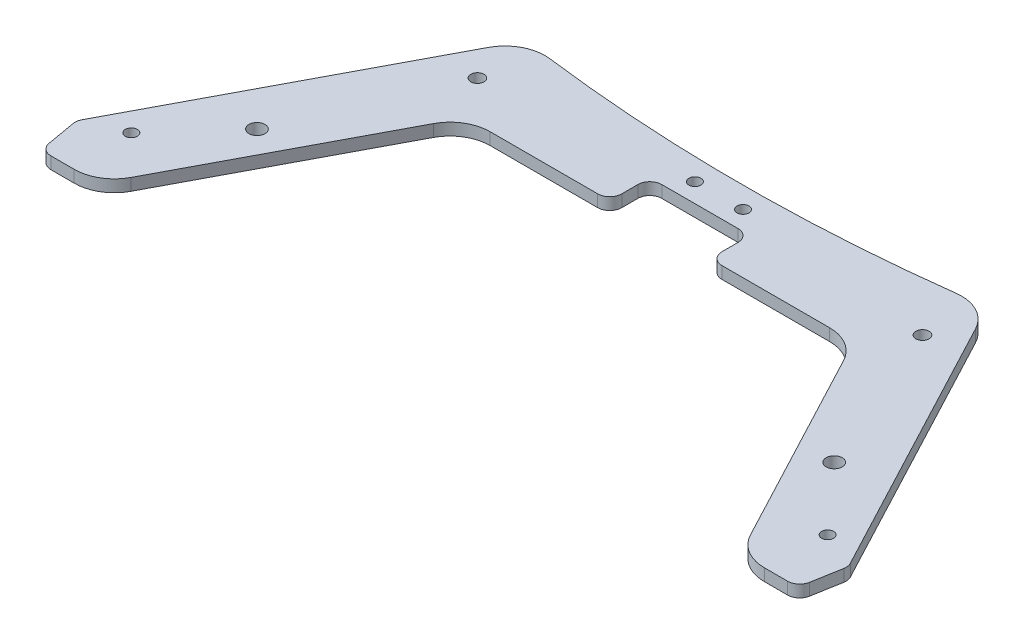
from build123d import *

# Parameters (mm, degrees)
SKETCH_1_R          = 2
EXTRUDE_1_DEPTH     = 3
SKETCH_2_R          = 1.5
CUT_EXTRUDE_1_DEPTH = 129.924848176
CUT_EXTRUDE_2_DEPTH = 3
CUT_EXTRUDE_3_DEPTH = 3
CUT_EXTRUDE_4_DEPTH = 129.924848176
FILLET_1_R          = 10
SKETCH_6_R          = 1.25
CUT_EXTRUDE_5_DEPTH = 3
FILLET_2_R          = 10
FILLET_3_R          = 10
CUT_EXTRUDE_6_DEPTH = 127.707867559
FILLET_4_R          = 3
CUT_EXTRUDE_START   = -10
SKETCH_8_R          = 1.25
CUT_EXTRUDE_7_DEPTH = 10
SKETCH_9_R          = 1.65
SKETCH_9_R_2        = 1.5
CUT_EXTRUDE_8_DEPTH = 106.990151571
FILLET_5_R          = 10
SKETCH_10_W         = 25
SKETCH_10_H         = 20
CUT_EXTRUDE_9_DEPTH = 106.637525121
FILLET_6_R          = 3


with BuildPart() as part:
    # 草图1 → 凸台-拉伸1 (new body)
    # profile 1 of 3: a face of its own
    with BuildSketch(Plane(origin=(0, 0, 0), x_dir=(1, 0, 0), z_dir=(0, 1, 0))):
        with BuildLine():
            ThreePointArc((90, 50.256494602), (0, 40), (-90, 50.256494602))
            Line((-90, 50.256494602), (-90, -65))
            Line((-90, -65), (90, -65))
            Line((90, -65), (90, 50.256494602))
        make_face()
        with Locations(Location((-72, -8.5, 0), (0, 0, 270))):
            Circle(SKETCH_1_R, mode=Mode.SUBTRACT)
        with Locations(Location((72, -8.5, 0), (0, 0, 270))):
            Circle(SKETCH_1_R, mode=Mode.SUBTRACT)
    # profile 2 of 3: a face of its own
    with BuildSketch(Plane(origin=(0, 0, 0), x_dir=(1, 0, 0), z_dir=(0, 1, 0))):
        with BuildLine():
            Line((-90, -65), (-90, 50.256494602))
            ThreePointArc((-90, 50.256494602), (-100.687943549, 52.879943656), (-111.299669708, 55.796429581))
            Line((-111.299669708, 55.796429581), (-90, -65))
        make_face()
    # profile 3 of 3: a face of its own
    with BuildSketch(Plane(origin=(0, 0, 0), x_dir=(1, 0, 0), z_dir=(0, 1, 0))):
        with BuildLine():
            ThreePointArc((111.299669708, 55.796429581), (100.687943549, 52.879943656), (90, 50.256494602))
            Line((90, 50.256494602), (90, -65))
            Line((90, -65), (111.299669708, 55.796429581))
        make_face()
    extrude(amount=EXTRUDE_1_DEPTH)

    # 草图2 → 切除-拉伸1 (cut, through all)
    with BuildSketch(Plane(origin=(0, 0, 0), x_dir=(-1, 0, 0), z_dir=(0, -1, 0))):
        with Locations(Location((6, 28.25, 0), (0, 0, 90))):
            Circle(SKETCH_2_R)
        with Locations(Location((-6, 28.25, 0), (0, 0, 90))):
            Circle(SKETCH_2_R)
        with Locations(Location((6, 34.75, 0), (0, 0, 90))):
            Circle(SKETCH_2_R)
        with Locations(Location((-6, 34.75, 0), (0, 0, 90))):
            Circle(SKETCH_2_R)
    extrude(amount=-CUT_EXTRUDE_1_DEPTH, mode=Mode.SUBTRACT)

    # 草图3 → 切除-拉伸2 (cut)
    with BuildSketch(Plane(origin=(0, 3, 0), x_dir=(1, 0, 0), z_dir=(0, 1, 0))):
        with BuildLine():
            ThreePointArc((-45, -46.5), (-40, -41.5), (-35, -46.5))
            Line((-35, -46.5), (-35, 8.5))
            ThreePointArc((-35, 8.5), (-40, 3.5), (-45, 8.5))
            Line((-45, 8.5), (-45, -46.5))
        make_face()
        with BuildLine():
            ThreePointArc((-45, 8.5), (-40, 3.5), (-35, 8.5))
            Line((-35, 8.5), (-45, 8.5))
        make_face()
        with BuildLine():
            Line((-45, 8.5), (-35, 8.5))
            ThreePointArc((-35, 8.5), (-40, 13.5), (-45, 8.5))
        make_face()
        with BuildLine():
            ThreePointArc((-45, -46.5), (-40, -51.5), (-35, -46.5))
            Line((-35, -46.5), (-45, -46.5))
        make_face()
        with BuildLine():
            Line((-45, -46.5), (-35, -46.5))
            ThreePointArc((-35, -46.5), (-40, -41.5), (-45, -46.5))
        make_face()
        with BuildLine():
            ThreePointArc((45, 8.5), (40, 3.5), (35, 8.5))
            Line((35, 8.5), (35, -46.5))
            ThreePointArc((35, -46.5), (40, -41.5), (45, -46.5))
            Line((45, -46.5), (45, 8.5))
        make_face()
        with BuildLine():
            ThreePointArc((45, -46.5), (40, -41.5), (35, -46.5))
            Line((35, -46.5), (45, -46.5))
        make_face()
        with BuildLine():
            Line((45, -46.5), (35, -46.5))
            ThreePointArc((35, -46.5), (40, -51.5), (45, -46.5))
        make_face()
        with BuildLine():
            ThreePointArc((45, 8.5), (40, 13.5), (35, 8.5))
            Line((35, 8.5), (45, 8.5))
        make_face()
        with BuildLine():
            Line((45, 8.5), (35, 8.5))
            ThreePointArc((35, 8.5), (40, 3.5), (45, 8.5))
        make_face()
    extrude(amount=-CUT_EXTRUDE_2_DEPTH, mode=Mode.SUBTRACT)

    # 草图4 → 切除-拉伸3 (cut)
    with BuildSketch(Plane(origin=(0, 3, 0), x_dir=(1, 0, 0), z_dir=(0, 1, 0))):
        with BuildLine():
            Line((45, -41.966401061), (45, -27.473665961))
            ThreePointArc((45, -27.473665961), (39.285969894, -12.835001066), (40.990143514, 2.78666473))
            Line((40.990143514, 2.78666473), (35, 4.966898668))
            Line((35, 4.966898668), (35, -30.4089023))
            ThreePointArc((35, -30.4089023), (39.482405618, -36.635494586), (45, -41.966401061))
        make_face()
        with BuildLine():
            Line((35, 4.966898668), (31.593217306, 6.206866163))
            ThreePointArc((31.593217306, 6.206866163), (29.1849194, -12.483575431), (35, -30.4089023))
            Line((35, -30.4089023), (35, 4.966898668))
        make_face()
        with BuildLine():
            Line((72, -51.5), (72, -41.5))
            ThreePointArc((72, -41.5), (56.787028178, -37.784219101), (45, -27.473665961))
            Line((45, -27.473665961), (45, -41.966401061))
            ThreePointArc((45, -41.966401061), (57.6831436, -49.046610497), (72, -51.5))
        make_face()
    extrude(amount=-CUT_EXTRUDE_3_DEPTH, mode=Mode.SUBTRACT)

    # 草图5 → 切除-拉伸4 (cut, through all)
    with BuildSketch(Plane(origin=(0, 3, 0), x_dir=(1, 0, 0), z_dir=(0, 1, 0))):
        Polygon((23, 15), (23, -55), (88, -55), (51, 15), align=None)
        Polygon((-88, -55), (-51, 15), (-23, 15), (-23, -55), align=None)
    extrude(amount=-CUT_EXTRUDE_4_DEPTH, mode=Mode.SUBTRACT)

    # 圆角1
    fillet_1_edges = [part.edges().sort_by_distance(p)[0] for p in [
        (23, 1.5, -15),
        (51, 1.5, -15),
        (88, 1.5, 55),
        (23, 1.5, 55),
        (-23, 1.5, 55),
        (-88, 1.5, 55),
        (-51, 1.5, -15),
        (-23, 1.5, -15),
    ]]
    fillet(fillet_1_edges, radius=FILLET_1_R)

    # 草图6 → 切除-拉伸5 (cut)
    with BuildSketch(Plane(origin=(0, 3, 0), x_dir=(1, 0, 0), z_dir=(0, 1, 0))):
        with Locations(Location((0, -59, 0), (0, 0, 270))):
            Circle(SKETCH_6_R)
        with Locations(Location((0, -51.5, 0), (0, 0, 270))):
            Circle(SKETCH_6_R)
        with Locations(Location((0, -44, 0), (0, 0, 270))):
            Circle(SKETCH_6_R)
        with Locations(Location((0, -36.5, 0), (0, 0, 270))):
            Circle(SKETCH_6_R)
        with Locations(Location((0, -29, 0), (0, 0, 270))):
            Circle(SKETCH_6_R)
        with Locations(Location((0, -21.5, 0), (0, 0, 270))):
            Circle(SKETCH_6_R)
        with Locations(Location((0, -14, 0), (0, 0, 270))):
            Circle(SKETCH_6_R)
        with Locations(Location((0, -6.5, 0), (0, 0, 270))):
            Circle(SKETCH_6_R)
        with Locations(Location((0, 1, 0), (0, 0, 270))):
            Circle(SKETCH_6_R)
        with Locations(Location((0, 8.5, 0), (0, 0, 270))):
            Circle(SKETCH_6_R)
        with Locations(Location((0, 16, 0), (0, 0, 270))):
            Circle(SKETCH_6_R)
    extrude(amount=-CUT_EXTRUDE_5_DEPTH, mode=Mode.SUBTRACT)

    # 圆角2
    fillet_2_edges = [part.edges().sort_by_distance(p)[0] for p in [
        (90, 1.5, 65),
        (-90, 1.5, 65),
    ]]
    fillet(fillet_2_edges, radius=FILLET_2_R)

    # 圆角3
    fillet_3_edges = [part.edges().sort_by_distance(p)[0] for p in [
        (111.299669708, 1.5, -55.796429581),
        (-111.299669708, 1.5, -55.796429581),
    ]]
    fillet(fillet_3_edges, radius=FILLET_3_R)

    # 草图7 → 切除-拉伸6 (cut, through all)
    with BuildSketch(Plane(origin=(0, 3, 0), x_dir=(1, 0, 0), z_dir=(0, 1, 0))):
        Polygon((-65, 30), (-84.345864805, -6.600284766), (-92.1600328, 37.716064119), align=None)
        Polygon((84.345864805, -6.600284766), (92.1600328, 37.716064119), (65, 30), align=None)
    extrude(amount=-CUT_EXTRUDE_6_DEPTH, mode=Mode.SUBTRACT)

    # 圆角4
    fillet_4_edges = [part.edges().sort_by_distance(p)[0] for p in [
        (-92.1600328, 1.5, -37.716064119),
        (-65, 1.5, -30),
        (-84.345864805, 1.5, 6.600284766),
        (84.345864805, 1.5, 6.600284766),
        (65, 1.5, -30),
        (92.1600328, 1.5, -37.716064119),
    ]]
    fillet(fillet_4_edges, radius=FILLET_4_R)

    # 草图8 → 切除-拉伸7 (cut)
    # profile 1 of 3: a face of its own
    with BuildSketch(Plane(origin=(0, 3, 0), x_dir=(1, 0, 0), z_dir=(0, 1, 0)).offset(CUT_EXTRUDE_START)):
        with BuildLine():
            Line((-96.307233514, -29.229901242), (-80.258130563, 1.133266502))
            ThreePointArc((-80.258130563, 1.133266502), (-83.376089329, -0.428449113), (-85.864838643, 2.014243946))
            Line((-85.864838643, 2.014243946), (-91.328614944, 33.00085915))
            ThreePointArc((-91.328614944, 33.00085915), (-90.384312562, 35.748777877), (-87.554346089, 36.407605686))
            Line((-87.554346089, 36.407605686), (-68.563668687, 31.012424996))
            ThreePointArc((-68.563668687, 31.012424996), (-66.62487936, 29.305577344), (-66.731229463, 26.724701016))
            Line((-66.731229463, 26.724701016), (-57.517083989, 44.156868129))
            ThreePointArc((-57.517083989, 44.156868129), (-77.01064871, 47.483299737), (-96.315987752, 51.76910156))
            ThreePointArc((-96.315987752, 51.76910156), (-105.548135175, 49.372887426), (-108.571964976, 40.326847323))
            Line((-108.571964976, 40.326847323), (-96.307233514, -29.229901242))
        make_face()
    # profile 2 of 3: a face of its own
    with BuildSketch(Plane(origin=(0, 3, 0), x_dir=(1, 0, 0), z_dir=(0, 1, 0)).offset(CUT_EXTRUDE_START)):
        with BuildLine():
            Line((-80.071428571, -40), (-94.408174518, -40))
            Line((-94.408174518, -40), (-91.457081218, -56.736481777))
            ThreePointArc((-91.457081218, -56.736481777), (-88.036879785, -62.660444431), (-81.609003688, -65))
            Line((-81.609003688, -65), (81.609003688, -65))
            ThreePointArc((81.609003688, -65), (88.036879785, -62.660444431), (91.457081218, -56.736481777))
            Line((91.457081218, -56.736481777), (94.408174518, -40))
            Line((94.408174518, -40), (80.071428571, -40))
            Line((80.071428571, -40), (80.244232708, -40.326926744))
            ThreePointArc((80.244232708, -40.326926744), (79.968641807, -50.160875286), (71.403283305, -55))
            Line((71.403283305, -55), (33, -55))
            ThreePointArc((33, -55), (25.928932188, -52.071067812), (23, -45))
            Line((23, -45), (23, 5))
            ThreePointArc((23, 5), (25.928932188, 12.071067812), (33, 15))
            Line((33, 15), (44.974711876, 15))
            ThreePointArc((44.974711876, 15), (50.135587162, 13.565358503), (53.815661279, 9.673073256))
            Line((53.815661279, 9.673073256), (48.357142857, 20))
            Line((48.357142857, 20), (-48.357142857, 20))
            Line((-48.357142857, 20), (-53.815661279, 9.673073256))
            ThreePointArc((-53.815661279, 9.673073256), (-50.135587162, 13.565358503), (-44.974711876, 15))
            Line((-44.974711876, 15), (-33, 15))
            ThreePointArc((-33, 15), (-25.928932188, 12.071067812), (-23, 5))
            Line((-23, 5), (-23, -45))
            ThreePointArc((-23, -45), (-25.928932188, -52.071067812), (-33, -55))
            Line((-33, -55), (-71.403283305, -55))
            ThreePointArc((-71.403283305, -55), (-79.968641807, -50.160875286), (-80.244232708, -40.326926744))
            Line((-80.244232708, -40.326926744), (-80.071428571, -40))
        make_face()
        with Locations((0, -59)):
            Circle(SKETCH_8_R, mode=Mode.SUBTRACT)
        with Locations((0, -51.5)):
            Circle(SKETCH_8_R, mode=Mode.SUBTRACT)
        with Locations((0, -44)):
            Circle(SKETCH_8_R, mode=Mode.SUBTRACT)
        with Locations((0, -36.5)):
            Circle(SKETCH_8_R, mode=Mode.SUBTRACT)
        with Locations((0, -29)):
            Circle(SKETCH_8_R, mode=Mode.SUBTRACT)
        with Locations((0, -21.5)):
            Circle(SKETCH_8_R, mode=Mode.SUBTRACT)
        with Locations((0, -14)):
            Circle(SKETCH_8_R, mode=Mode.SUBTRACT)
        with Locations((0, -6.5)):
            Circle(SKETCH_8_R, mode=Mode.SUBTRACT)
        with Locations((0, 1)):
            Circle(SKETCH_8_R, mode=Mode.SUBTRACT)
        with Locations((0, 8.5)):
            Circle(SKETCH_8_R, mode=Mode.SUBTRACT)
        with Locations((0, 16)):
            Circle(SKETCH_8_R, mode=Mode.SUBTRACT)
    # profile 3 of 3: a face of its own
    with BuildSketch(Plane(origin=(0, 3, 0), x_dir=(1, 0, 0), z_dir=(0, 1, 0)).offset(CUT_EXTRUDE_START)):
        with BuildLine():
            ThreePointArc((96.315987752, 51.76910156), (77.01064871, 47.483299737), (57.517083989, 44.156868129))
            Line((57.517083989, 44.156868129), (66.731229463, 26.724701016))
            ThreePointArc((66.731229463, 26.724701016), (66.62487936, 29.305577344), (68.563668687, 31.012424996))
            Line((68.563668687, 31.012424996), (87.554346089, 36.407605686))
            ThreePointArc((87.554346089, 36.407605686), (90.384312562, 35.748777877), (91.328614944, 33.00085915))
            Line((91.328614944, 33.00085915), (85.864838643, 2.014243946))
            ThreePointArc((85.864838643, 2.014243946), (83.376089329, -0.428449113), (80.258130563, 1.133266502))
            Line((80.258130563, 1.133266502), (96.307233514, -29.229901242))
            Line((96.307233514, -29.229901242), (108.571964976, 40.326847323))
            ThreePointArc((108.571964976, 40.326847323), (105.548135175, 49.372887426), (96.315987752, 51.76910156))
        make_face()
    extrude(amount=CUT_EXTRUDE_7_DEPTH, mode=Mode.SUBTRACT)

    # 草图9 → 切除-拉伸8 (cut, through all)
    with BuildSketch(Plane(origin=(0, 3, 0), x_dir=(1, 0, 0), z_dir=(0, 1, 0))):
        with Locations(Location((-55.513531222, 30, 0), (0, 0, 270))):
            Circle(SKETCH_9_R)
        with Locations(Location((-86.847160275, -25, 0), (0, 0, 270))):
            Circle(SKETCH_9_R_2)
        with Locations(Location((86.847160275, -25, 0), (0, 0, 90))):
            Circle(SKETCH_9_R_2)
        with Locations(Location((55.513531222, 30, 0), (0, 0, 90))):
            Circle(SKETCH_9_R)
    extrude(amount=-CUT_EXTRUDE_8_DEPTH, mode=Mode.SUBTRACT)

    # 圆角5
    fillet_5_edges = [part.edges().sort_by_distance(p)[0] for p in [
        (-48.357142857, 1.5, -20),
        (80.071428571, 1.5, 40),
        (48.357142857, 1.5, -20),
        (-80.071428571, 1.5, 40),
        (57.517083989, 1.5, -44.156868129),
        (-57.517083989, 1.5, -44.156868129),
    ]]
    fillet(fillet_5_edges, radius=FILLET_5_R)

    # 草图10 → 切除-拉伸9 (cut, through all)
    with BuildSketch(Plane(origin=(0, 3, 0), x_dir=(1, 0, 0), z_dir=(0, 1, 0))):
        with Locations((0, 20)):
            Rectangle(SKETCH_10_W, SKETCH_10_H)
    extrude(amount=-CUT_EXTRUDE_9_DEPTH, mode=Mode.SUBTRACT)

    # 圆角6
    fillet_6_edges = [part.edges().sort_by_distance(p)[0] for p in [
        (-94.408174518, 1.5, 40),
        (94.408174518, 1.5, 40),
        (-96.307233514, 1.5, 29.229901242),
        (96.307233514, 1.5, 29.229901242),
        (-12.5, 1.5, -20),
        (12.5, 1.5, -20),
        (12.5, 1.5, -30),
        (-12.5, 1.5, -30),
    ]]
    fillet(fillet_6_edges, radius=FILLET_6_R)


solid = part.part
